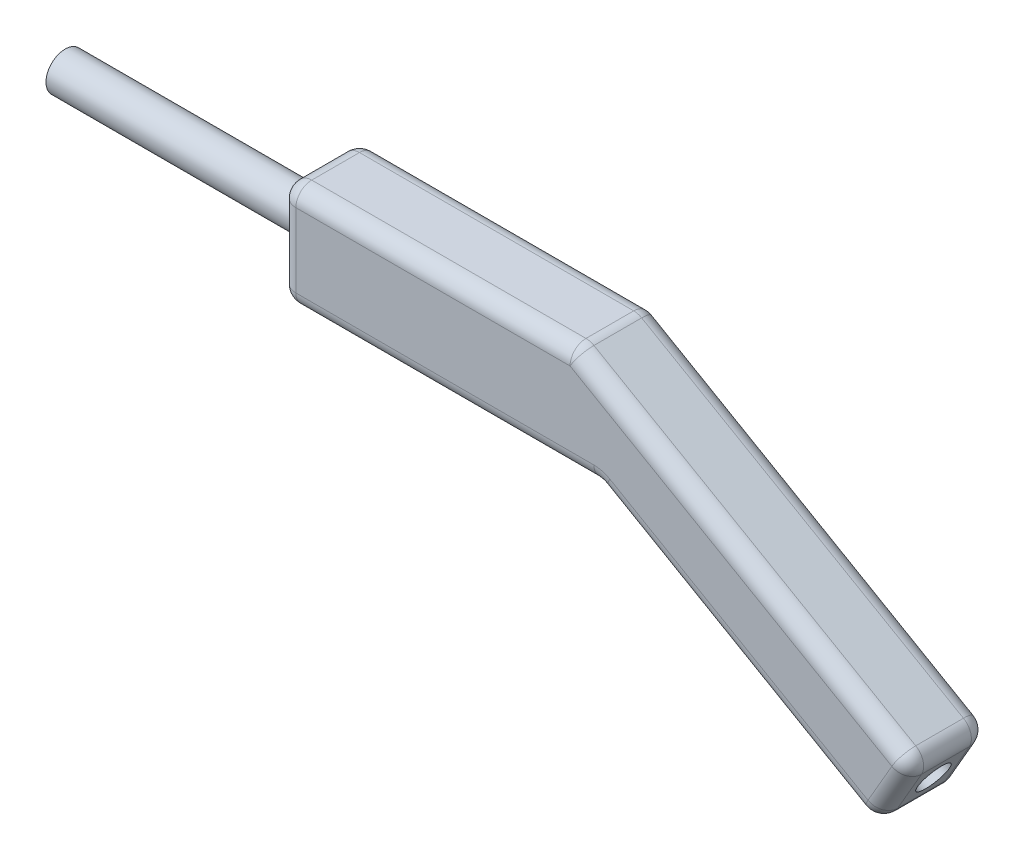
from build123d import *

# Parameters (mm, degrees)
EXTRUDE_1_DEPTH     = 2.5
SKETCH_2_R          = 0.5
CUT_EXTRUDE_1_DEPTH = 8
SKETCH_3_R          = 0.6
EXTRUDE_2_DEPTH     = 8
FILLET_1_R          = 0.5


with BuildPart() as part:
    # 草图1 → 凸台-拉伸1 (new body)
    with BuildSketch(Plane.XY):
        Polygon((1.315447425, 1.536749297), (11.975701463, -4.617951242), (10.725701463, -6.783014751), (2.065447425, -1.783014751), (-7.934552575, -1.783014751), (-7.934552575, 1.536749297), align=None)
    extrude(amount=EXTRUDE_1_DEPTH)

    # 草图2 → 切除-拉伸1 (cut)
    with BuildSketch(Plane(origin=(10.981407641, -6.340118658, 0), x_dir=(0, 0, -1), z_dir=(0.8660254037844386, -0.5, 0))):
        with Locations(Location((-1.25, 0.738587643, 0), (0, 0, 90))):
            Circle(SKETCH_2_R)
    extrude(amount=-CUT_EXTRUDE_1_DEPTH, mode=Mode.SUBTRACT)

    # 草图3 → 凸台-拉伸2 (add)
    with BuildSketch(Plane.ZY.offset(7.934552575)):
        with Locations((1.25, -0.123132727)):
            Circle(SKETCH_3_R)
    extrude(amount=EXTRUDE_2_DEPTH)

    # 圆角1
    fillet_1_edges = [part.edges().sort_by_distance(p)[0] for p in [
        (2.065447425, -1.783014751, 1.25),
        (-7.934552575, -1.783014751, 1.25),
        (-7.934552575, 1.536749297, 1.25),
        (1.315447425, 1.536749297, 1.25),
        (11.975701463, -4.617951242, 1.25),
        (10.725701463, -6.783014751, 1.25),
        (6.645574444, -1.540600973, 2.5),
        (-3.309552575, 1.536749297, 2.5),
        (-7.934552575, -0.123132727, 2.5),
        (-2.934552575, -1.783014751, 2.5),
        (6.395574444, -4.283014751, 2.5),
        (-2.934552575, -1.783014751, 0),
        (-7.934552575, -0.123132727, 0),
        (-3.309552575, 1.536749297, 0),
        (6.645574444, -1.540600973, 0),
        (11.350701463, -5.700482996, 0),
        (6.395574444, -4.283014751, 0),
        (11.350701463, -5.700482996, 2.5),
    ]]
    fillet(fillet_1_edges, radius=FILLET_1_R)


solid = part.part
